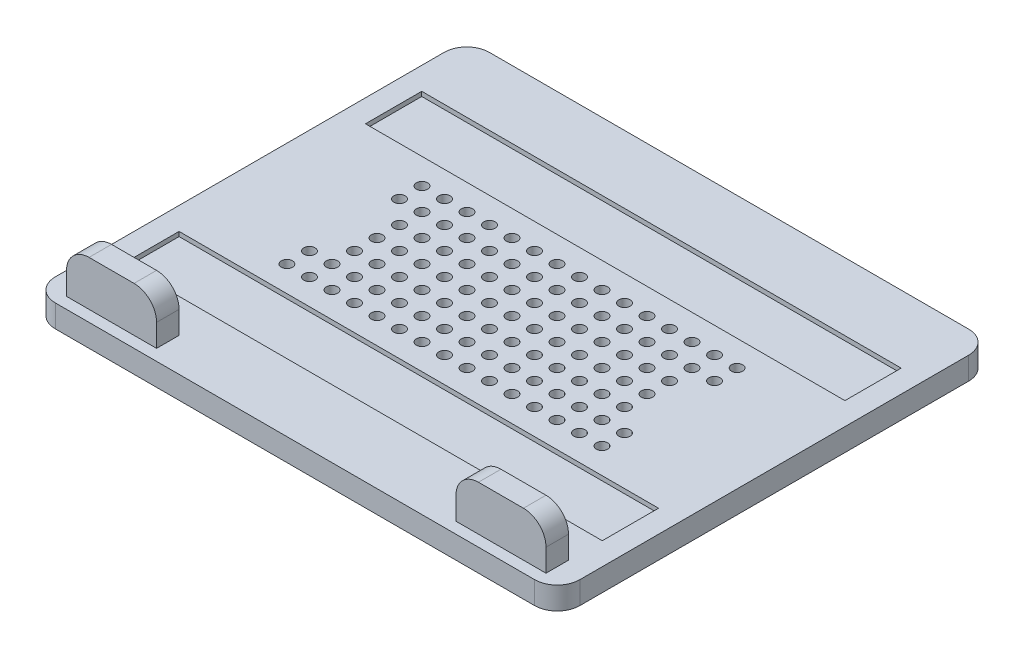
from build123d import *

# Parameters (mm, degrees)
SKETCH1_W               = 295.91
SKETCH1_H               = 244.856
BOSS_EXTRUDE1_DEPTH     = 12.7
SKETCH2_R               = 3.175
CUT_EXTRUDE1_DEPTH      = 193.459313126
MIRROR6_COPY_1_SKETCH_R = 3.175
MIRROR6_COPY_1_DEPTH    = 193.459313126
SKETCH3_W               = 50.8
SKETCH3_H               = 12.7
BOSS_EXTRUDE2_DEPTH     = 25.4
FILLET1_R               = 12.7
FILLET1_OF_MIRROR7_R    = 12.7
FILLET2_R               = 12.7
SKETCH4_W               = 270.51
SKETCH4_H               = 31.75
CUT_EXTRUDE2_DEPTH      = 2.54
SKETCH5_W               = 12.7
SKETCH5_H               = 25.4
BOSS_EXTRUDE3_DEPTH     = 19.05
BOSS_EXTRUDE4_DEPTH     = 12.7
CUT_EXTRUDE3_REACH      = 295.028
SKETCH8_R               = 6.35


with BuildPart() as part:
    # Sketch1 → Boss-Extrude1 (new body)
    with BuildSketch(Plane(origin=(0, 0, 0), x_dir=(1, 0, 0), z_dir=(0, 1, 0))):
        Rectangle(SKETCH1_W, SKETCH1_H)
    extrude(amount=BOSS_EXTRUDE1_DEPTH)

    # Sketch2 → Cut-Extrude1 (cut, through all)
    with BuildSketch(Plane(origin=(0, 12.7, 0), x_dir=(1, 0, 0), z_dir=(0, 1, 0))):
        with Locations(Location((0, 0, 0), (0, 0, 270))):
            Circle(SKETCH2_R)
        with Locations(Location((12.7, 0, 0), (0, 0, 270))):
            Circle(SKETCH2_R)
        with Locations(Location((25.4, 0, 0), (0, 0, 270))):
            Circle(SKETCH2_R)
        with Locations(Location((38.1, 0, 0), (0, 0, 270))):
            Circle(SKETCH2_R)
        with Locations(Location((50.8, 0, 0), (0, 0, 270))):
            Circle(SKETCH2_R)
        with Locations(Location((63.5, 0, 0), (0, 0, 270))):
            Circle(SKETCH2_R)
        with Locations(Location((76.2, 0, 0), (0, 0, 270))):
            Circle(SKETCH2_R)
        with Locations(Location((12.7, 12.7, 0), (0, 0, 270))):
            Circle(SKETCH2_R)
        with Locations(Location((25.4, 12.7, 0), (0, 0, 270))):
            Circle(SKETCH2_R)
        with Locations(Location((38.1, 12.7, 0), (0, 0, 270))):
            Circle(SKETCH2_R)
        with Locations(Location((50.8, 12.7, 0), (0, 0, 270))):
            Circle(SKETCH2_R)
        with Locations(Location((63.5, 12.7, 0), (0, 0, 270))):
            Circle(SKETCH2_R)
        with Locations(Location((76.2, 12.7, 0), (0, 0, 270))):
            Circle(SKETCH2_R)
        with Locations(Location((12.7, 25.4, 0), (0, 0, 270))):
            Circle(SKETCH2_R)
        with Locations(Location((25.4, 25.4, 0), (0, 0, 270))):
            Circle(SKETCH2_R)
        with Locations(Location((38.1, 25.4, 0), (0, 0, 270))):
            Circle(SKETCH2_R)
        with Locations(Location((50.8, 25.4, 0), (0, 0, 270))):
            Circle(SKETCH2_R)
        with Locations(Location((63.5, 25.4, 0), (0, 0, 270))):
            Circle(SKETCH2_R)
        with Locations(Location((76.2, 25.4, 0), (0, 0, 270))):
            Circle(SKETCH2_R)
        with Locations(Location((88.9, 25.4, 0), (0, 0, 270))):
            Circle(SKETCH2_R)
        with Locations(Location((12.7, 38.1, 0), (0, 0, 270))):
            Circle(SKETCH2_R)
        with Locations(Location((25.4, 38.1, 0), (0, 0, 270))):
            Circle(SKETCH2_R)
        with Locations(Location((38.1, 38.1, 0), (0, 0, 270))):
            Circle(SKETCH2_R)
        with Locations(Location((50.8, 38.1, 0), (0, 0, 270))):
            Circle(SKETCH2_R)
        with Locations(Location((63.5, 38.1, 0), (0, 0, 270))):
            Circle(SKETCH2_R)
        with Locations(Location((76.2, 38.1, 0), (0, 0, 270))):
            Circle(SKETCH2_R)
        with Locations(Location((88.9, 38.1, 0), (0, 0, 270))):
            Circle(SKETCH2_R)
        with Locations(Location((0, 12.7, 0), (0, 0, 270))):
            Circle(SKETCH2_R)
        with Locations(Location((0, 25.4, 0), (0, 0, 270))):
            Circle(SKETCH2_R)
        with Locations(Location((0, 38.1, 0), (0, 0, 270))):
            Circle(SKETCH2_R)
    cut_extrude1 = extrude(amount=-CUT_EXTRUDE1_DEPTH, mode=Mode.SUBTRACT)

    # Mirror5: Cut-Extrude1 across plane
    add(cut_extrude1.mirror(Plane.XY), mode=Mode.SUBTRACT)

    # Mirror6: Cut-Extrude1 across plane
    add(cut_extrude1.mirror(Plane(origin=(0, 0, 0), x_dir=(0, 0, 1), z_dir=(1, 0, 0))), mode=Mode.SUBTRACT)

    # Mirror6 copy 1 sketch → Mirror6 copy 1 (cut, through all)
    with BuildSketch(Plane(origin=(0, 12.7, 0), x_dir=(-1, 0, 0), z_dir=(0, 1, 0))):
        with Locations(Location((0, 0, 0), (0, 0, 270))):
            Circle(MIRROR6_COPY_1_SKETCH_R)
        with Locations(Location((12.7, 0, 0), (0, 0, 270))):
            Circle(MIRROR6_COPY_1_SKETCH_R)
        with Locations(Location((25.4, 0, 0), (0, 0, 270))):
            Circle(MIRROR6_COPY_1_SKETCH_R)
        with Locations(Location((38.1, 0, 0), (0, 0, 270))):
            Circle(MIRROR6_COPY_1_SKETCH_R)
        with Locations(Location((50.8, 0, 0), (0, 0, 270))):
            Circle(MIRROR6_COPY_1_SKETCH_R)
        with Locations(Location((63.5, 0, 0), (0, 0, 270))):
            Circle(MIRROR6_COPY_1_SKETCH_R)
        with Locations(Location((76.2, 0, 0), (0, 0, 270))):
            Circle(MIRROR6_COPY_1_SKETCH_R)
        with Locations(Location((12.7, 12.7, 0), (0, 0, 270))):
            Circle(MIRROR6_COPY_1_SKETCH_R)
        with Locations(Location((25.4, 12.7, 0), (0, 0, 270))):
            Circle(MIRROR6_COPY_1_SKETCH_R)
        with Locations(Location((38.1, 12.7, 0), (0, 0, 270))):
            Circle(MIRROR6_COPY_1_SKETCH_R)
        with Locations(Location((50.8, 12.7, 0), (0, 0, 270))):
            Circle(MIRROR6_COPY_1_SKETCH_R)
        with Locations(Location((63.5, 12.7, 0), (0, 0, 270))):
            Circle(MIRROR6_COPY_1_SKETCH_R)
        with Locations(Location((76.2, 12.7, 0), (0, 0, 270))):
            Circle(MIRROR6_COPY_1_SKETCH_R)
        with Locations(Location((12.7, 25.4, 0), (0, 0, 270))):
            Circle(MIRROR6_COPY_1_SKETCH_R)
        with Locations(Location((25.4, 25.4, 0), (0, 0, 270))):
            Circle(MIRROR6_COPY_1_SKETCH_R)
        with Locations(Location((38.1, 25.4, 0), (0, 0, 270))):
            Circle(MIRROR6_COPY_1_SKETCH_R)
        with Locations(Location((50.8, 25.4, 0), (0, 0, 270))):
            Circle(MIRROR6_COPY_1_SKETCH_R)
        with Locations(Location((63.5, 25.4, 0), (0, 0, 270))):
            Circle(MIRROR6_COPY_1_SKETCH_R)
        with Locations(Location((76.2, 25.4, 0), (0, 0, 270))):
            Circle(MIRROR6_COPY_1_SKETCH_R)
        with Locations(Location((88.9, 25.4, 0), (0, 0, 270))):
            Circle(MIRROR6_COPY_1_SKETCH_R)
        with Locations(Location((12.7, 38.1, 0), (0, 0, 270))):
            Circle(MIRROR6_COPY_1_SKETCH_R)
        with Locations(Location((25.4, 38.1, 0), (0, 0, 270))):
            Circle(MIRROR6_COPY_1_SKETCH_R)
        with Locations(Location((38.1, 38.1, 0), (0, 0, 270))):
            Circle(MIRROR6_COPY_1_SKETCH_R)
        with Locations(Location((50.8, 38.1, 0), (0, 0, 270))):
            Circle(MIRROR6_COPY_1_SKETCH_R)
        with Locations(Location((63.5, 38.1, 0), (0, 0, 270))):
            Circle(MIRROR6_COPY_1_SKETCH_R)
        with Locations(Location((76.2, 38.1, 0), (0, 0, 270))):
            Circle(MIRROR6_COPY_1_SKETCH_R)
        with Locations(Location((88.9, 38.1, 0), (0, 0, 270))):
            Circle(MIRROR6_COPY_1_SKETCH_R)
        with Locations(Location((0, 12.7, 0), (0, 0, 270))):
            Circle(MIRROR6_COPY_1_SKETCH_R)
        with Locations(Location((0, 25.4, 0), (0, 0, 270))):
            Circle(MIRROR6_COPY_1_SKETCH_R)
        with Locations(Location((0, 38.1, 0), (0, 0, 270))):
            Circle(MIRROR6_COPY_1_SKETCH_R)
    extrude(amount=-MIRROR6_COPY_1_DEPTH, mode=Mode.SUBTRACT)

    # Sketch3 → Boss-Extrude2 (add)
    with BuildSketch(Plane(origin=(0, 12.7, 0), x_dir=(1, 0, 0), z_dir=(0, 1, 0))):
        with Locations((-109.855, -109.728)):
            Rectangle(SKETCH3_W, SKETCH3_H)
    boss_extrude2 = extrude(amount=BOSS_EXTRUDE2_DEPTH)

    # Fillet1
    fillet1_edges = [part.edges().sort_by_distance(p)[0] for p in [
        (-84.455, 38.1, 109.728),
        (-135.255, 38.1, 109.728),
    ]]
    fillet(fillet1_edges, radius=FILLET1_R)

    # Mirror7: Boss-Extrude2 across plane
    add(boss_extrude2.mirror(Plane(origin=(0, 0, 0), x_dir=(0, 0, 1), z_dir=(1, 0, 0))))

    # Fillet1 of Mirror7
    fillet1_of_mirror7_edges = [part.edges().sort_by_distance(p)[0] for p in [
        (84.455, 38.1, 109.728),
        (135.255, 38.1, 109.728),
    ]]
    fillet(fillet1_of_mirror7_edges, radius=FILLET1_OF_MIRROR7_R)

    # Fillet2
    fillet2_edges = [part.edges().sort_by_distance(p)[0] for p in [
        (147.955, 6.35, 122.428),
        (-147.955, 6.35, 122.428),
        (-147.955, 6.35, -122.428),
        (147.955, 6.35, -122.428),
    ]]
    fillet(fillet2_edges, radius=FILLET2_R)

    # Sketch4 → Cut-Extrude2 (cut)
    with BuildSketch(Plane(origin=(0, 12.7, 0), x_dir=(1, 0, 0), z_dir=(0, 1, 0))):
        with Locations((0, 68.453)):
            Rectangle(SKETCH4_W, SKETCH4_H)
        with Locations((0, -68.453)):
            Rectangle(SKETCH4_W, SKETCH4_H)
    extrude(amount=-CUT_EXTRUDE2_DEPTH, mode=Mode.SUBTRACT)

    # Sketch5 → Boss-Extrude3 (add)
    with BuildSketch(Plane.XZ):
        with Locations((-109.1819, 0)):
            Rectangle(SKETCH5_W, SKETCH5_H)
    boss_extrude3 = extrude(amount=BOSS_EXTRUDE3_DEPTH)

    # Sketch6 → Boss-Extrude4 (add)
    with BuildSketch(Plane.ZY.offset(115.5319)):
        with BuildLine():
            Line((-12.7, -19.05), (12.7, -19.05))
            ThreePointArc((12.7, -19.05), (0, -31.75), (-12.7, -19.05))
        make_face()
    boss_extrude4 = extrude(amount=-BOSS_EXTRUDE4_DEPTH)

    # Mirror10: Boss-Extrude3, Boss-Extrude4 across plane
    add(boss_extrude3.mirror(Plane(origin=(0, 0, 0), x_dir=(0, 0, 1), z_dir=(1, 0, 0))))
    add(boss_extrude4.mirror(Plane(origin=(0, 0, 0), x_dir=(0, 0, 1), z_dir=(1, 0, 0))))

    # Cut-Extrude3: up to this face of the body (flat: up to its plane)
    cut_extrude3_end = Plane(part.part.faces().sort_by_distance((-115.5319, -14.650693644, 0))[0])
    # Sketch8 → Cut-Extrude3 (cut, up to the picked face)
    with BuildSketch(Plane(origin=(115.5319, 0, 0), x_dir=(0, 0, -1), z_dir=(1, 0, 0)), mode=Mode.PRIVATE) as cut_extrude3_sk1:
        with Locations((0, -17.78)):
            Circle(SKETCH8_R)
    cut_extrude3_tool1 = split(extrude(cut_extrude3_sk1.sketch, amount=-CUT_EXTRUDE3_REACH, mode=Mode.PRIVATE), bisect_by=cut_extrude3_end, keep=Keep.BOTH, mode=Mode.PRIVATE)
    add(cut_extrude3_tool1.solids().sort_by(Axis((115.5319, -17.78, 0), (-1, 0, 0)))[0], mode=Mode.SUBTRACT)


solid = part.part
